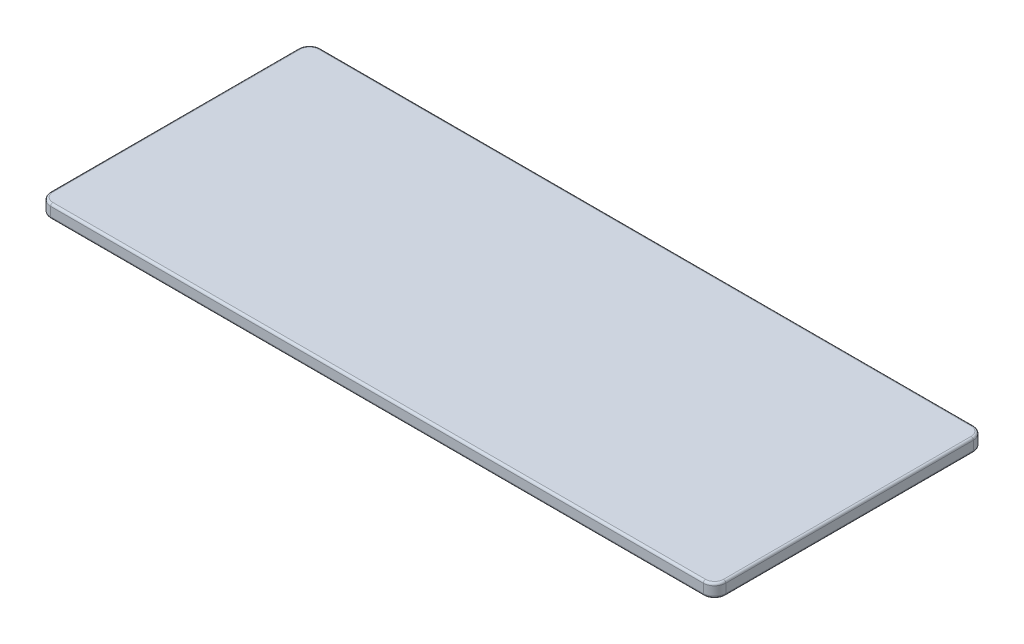
from build123d import *

# Parameters (mm, degrees)
SKETCH_1_W      = 1500
SKETCH_1_H      = 600
EXTRUDE_1_DEPTH = 30
FILLET_1_R      = 25
FILLET_2_R      = 5


with BuildPart() as part:
    # 草图1 → 凸台-拉伸1 (new body)
    with BuildSketch(Plane(origin=(0, 0, 0), x_dir=(1, 0, 0), z_dir=(0, 1, 0))):
        Rectangle(SKETCH_1_W, SKETCH_1_H)
    extrude(amount=EXTRUDE_1_DEPTH)

    # 圆角1
    fillet_1_edges = [part.edges().sort_by_distance(p)[0] for p in [
        (750, 15, 300),
        (-750, 15, 300),
        (-750, 15, -300),
        (750, 15, -300),
    ]]
    fillet(fillet_1_edges, radius=FILLET_1_R)

    # 圆角2
    fillet_2_edges = [part.edges().sort_by_distance(p)[0] for p in [
        (0, 0, -300),
        (0, 30, -300),
        (750, 0, 0),
        (0, 0, 300),
        (-750, 0, 0),
        (-742.67766953, 0, 292.67766953),
        (-742.67766953, 0, -292.67766953),
        (742.67766953, 0, 292.67766953),
        (742.67766953, 0, -292.67766953),
        (750, 30, 0),
        (-750, 30, 0),
        (0, 30, 300),
        (-742.67766953, 30, 292.67766953),
        (-742.67766953, 30, -292.67766953),
        (742.67766953, 30, 292.67766953),
        (742.67766953, 30, -292.67766953),
    ]]
    fillet(fillet_2_edges, radius=FILLET_2_R)


solid = part.part
